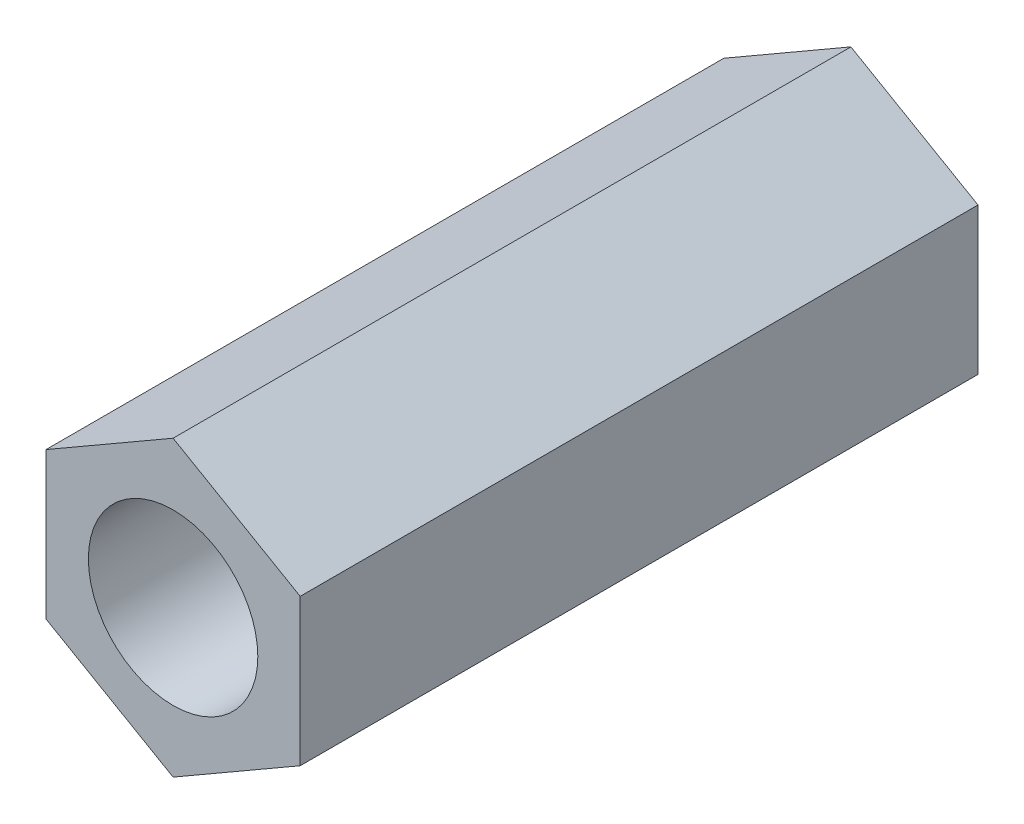
from build123d import *

# Parameters (mm, degrees)
SKETCH1_R           = 9.525
BOSS_EXTRUDE1_DEPTH = 76.2


with BuildPart() as part:
    # Sketch1 → Boss-Extrude1 (new body)
    with BuildSketch(Plane.XY):
        Polygon((14.2875, -8.248891971), (14.2875, 8.248891971), (0, 16.497783942), (-14.2875, 8.248891971), (-14.2875, -8.248891971), (0, -16.497783942), align=None)
        with Locations(Location((0, 0, 0), (0, 0, 180))):
            Circle(SKETCH1_R, mode=Mode.SUBTRACT)
    extrude(amount=BOSS_EXTRUDE1_DEPTH)


solid = part.part
